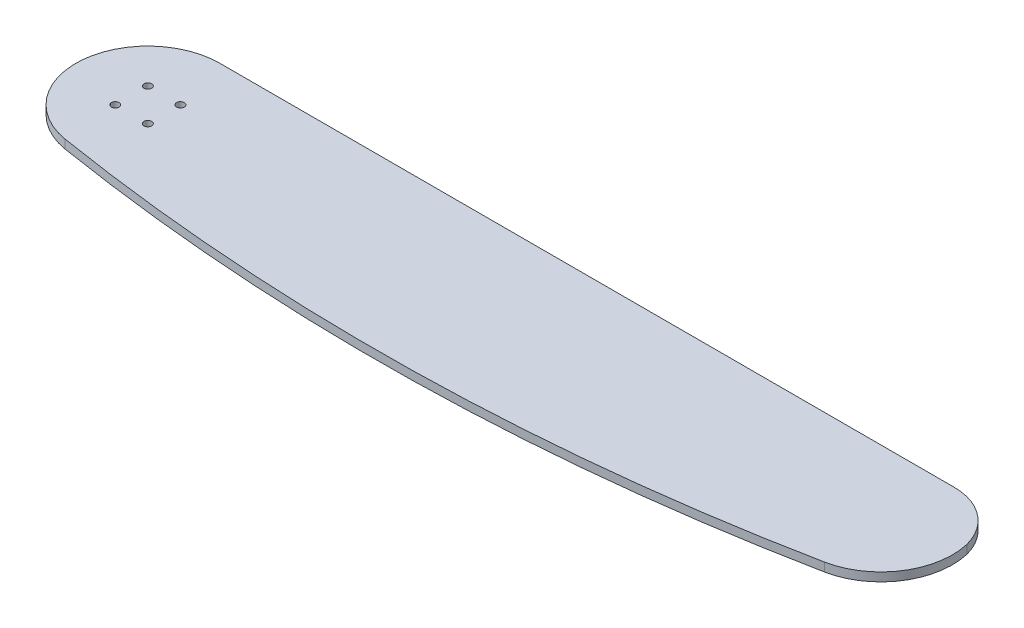
from build123d import *

# Parameters (mm, degrees)
SKETCH1_R           = 1.35
BOSS_EXTRUDE1_DEPTH = 3


with BuildPart() as part:
    # Sketch1 → Boss-Extrude1 (new body)
    with BuildSketch(Plane(origin=(0, 0, 0), x_dir=(1, 0, 0), z_dir=(0, 1, 0))):
        with BuildLine():
            Line((280, 50), (25, 50))
            ThreePointArc((25, 50), (0.080648745, 27.00647278), (21, 0.322074641))
            ThreePointArc((21, 0.322074641), (150.709603392, -8.943952981), (280, 5))
            ThreePointArc((280, 5), (296.028917332, 15.902478251), (299.356812448, 35))
            ThreePointArc((299.356812448, 35), (292.244245466, 45.811097932), (280, 50))
        make_face()
        with Locations(Location((19.343145751, 30.656854249, 0), (0, 0, 270))):
            Circle(SKETCH1_R, mode=Mode.SUBTRACT)
        with Locations(Location((30.656854249, 30.656854249, 0), (0, 0, 270))):
            Circle(SKETCH1_R, mode=Mode.SUBTRACT)
        with Locations(Location((19.343145751, 19.343145751, 0), (0, 0, 270))):
            Circle(SKETCH1_R, mode=Mode.SUBTRACT)
        with Locations(Location((30.656854249, 19.343145751, 0), (0, 0, 270))):
            Circle(SKETCH1_R, mode=Mode.SUBTRACT)
    extrude(amount=BOSS_EXTRUDE1_DEPTH)


solid = part.part
